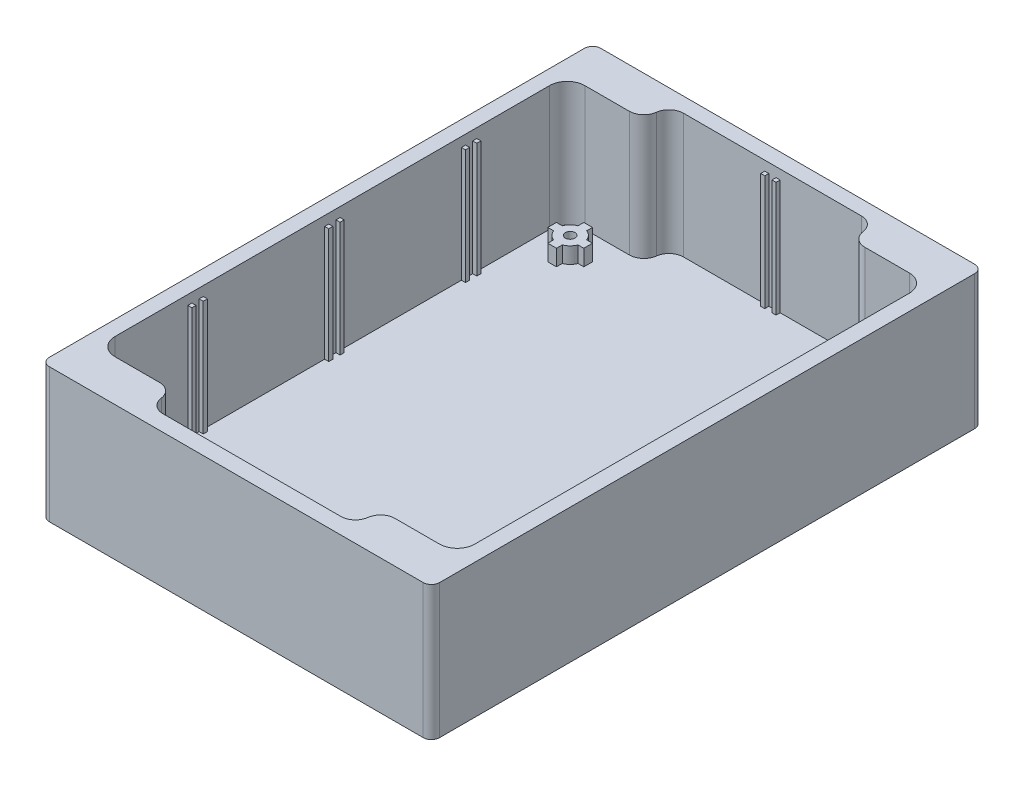
from build123d import *

# Parameters (mm, degrees)
BOSS_EXTRUDE1_DEPTH     = 41.656
CUT_EXTRUDE1_DEPTH      = 38.608
SKETCH7_R               = 1.5
BOSS_EXTRUDE2_DEPTH     = 5
MIRROR2_COPY_1_DEPTH    = 38.608
MIRROR2_COPY_2_SKETCH_R = 1.5
MIRROR2_COPY_2_DEPTH    = 5
BOSS_EXTRUDE3_START     = -2.9464
SKETCH9_W               = 1.27
SKETCH9_H               = 1.27
BOSS_EXTRUDE3_DEPTH     = 35.6616
BOSS_EXTRUDE4_START     = -2.9464
SKETCH10_W              = 1.27
SKETCH10_H              = 1.27
BOSS_EXTRUDE4_DEPTH     = 35.6616


with BuildPart() as part:
    # Sketch3 → Boss-Extrude1 (new body)
    with BuildSketch(Plane(origin=(0, 0, 0), x_dir=(1, 0, 0), z_dir=(0, 1, 0))):
        with BuildLine():
            Line((58.096932885, -85.686632753), (-57.828667115, -85.686632753))
            ThreePointArc((-57.828667115, -85.686632753), (-59.624718339, -84.942683977), (-60.368667115, -83.146632753))
            Line((-60.368667115, -83.146632753), (-60.368667115, 82.766167247))
            ThreePointArc((-60.368667115, 82.766167247), (-59.624718339, 84.562218471), (-57.828667115, 85.306167247))
            Line((-57.828667115, 85.306167247), (58.096932885, 85.306167247))
            ThreePointArc((58.096932885, 85.306167247), (59.892984109, 84.562218471), (60.636932885, 82.766167247))
            Line((60.636932885, 82.766167247), (60.636932885, -83.146632753))
            ThreePointArc((60.636932885, -83.146632753), (59.892984109, -84.942683977), (58.096932885, -85.686632753))
        make_face()
    extrude(amount=BOSS_EXTRUDE1_DEPTH)

    # Sketch6 → Cut-Extrude1 (cut)
    with BuildSketch(Plane(origin=(0, 41.656, 0), x_dir=(1, 0, 0), z_dir=(0, 1, 0))):
        with BuildLine():
            Line((-55.771267115, -0.190232753), (-55.771267115, 67.373392964))
            ThreePointArc((-55.771267115, 67.373392964), (-54.171667622, 71.235167754), (-50.309892833, 72.834767247))
            Line((-50.309892833, 72.834767247), (-36.517896511, 72.834767247))
            ThreePointArc((-36.517896511, 72.834767247), (-33.539782988, 73.959370118), (-32.04836951, 76.771767247))
            ThreePointArc((-32.04836951, 76.771767247), (-30.556956031, 79.584164375), (-27.578842508, 80.708767247))
            Line((-27.578842508, 80.708767247), (0.134132885, 80.708767247))
            Line((0.134132885, 80.708767247), (0.134132885, -0.190232753))
            Line((0.134132885, -0.190232753), (-55.771267115, -0.190232753))
        make_face()
    cut_extrude1 = extrude(amount=-CUT_EXTRUDE1_DEPTH, mode=Mode.SUBTRACT)

    # Sketch7 → Boss-Extrude2 (add)
    with BuildSketch(Plane(origin=(0, 3.048, 0), x_dir=(1, 0, 0), z_dir=(0, 1, 0))):
        with BuildLine():
            Line((-47.317674081, 67.712862285), (-47.317674081, 69.529651141))
            Line((-47.317674081, 69.529651141), (-44.630325919, 69.529651141))
            Line((-44.630325919, 69.529651141), (-44.630325919, 67.712862285))
            ThreePointArc((-44.630325919, 67.712862285), (-43.145219322, 66.773547925), (-42.205904962, 65.288441328))
            Line((-42.205904962, 65.288441328), (-40.389116105, 65.288441328))
            Line((-40.389116105, 65.288441328), (-40.389116105, 62.601093165))
            Line((-40.389116105, 62.601093165), (-42.205904962, 62.601093165))
            ThreePointArc((-42.205904962, 62.601093165), (-43.145219322, 61.115986569), (-44.630325919, 60.176672209))
            Line((-44.630325919, 60.176672209), (-44.630325919, 58.359883352))
            Line((-44.630325919, 58.359883352), (-47.317674081, 58.359883352))
            Line((-47.317674081, 58.359883352), (-47.317674081, 60.176672209))
            ThreePointArc((-47.317674081, 60.176672209), (-48.802780678, 61.115986569), (-49.742095038, 62.601093165))
            Line((-49.742095038, 62.601093165), (-51.558883895, 62.601093165))
            Line((-51.558883895, 62.601093165), (-51.558883895, 65.288441328))
            Line((-51.558883895, 65.288441328), (-49.742095038, 65.288441328))
            ThreePointArc((-49.742095038, 65.288441328), (-48.802780678, 66.773547925), (-47.317674081, 67.712862285))
        make_face()
        with Locations(Location((-45.974, 63.944767247, 0), (0, 0, 270))):
            Circle(SKETCH7_R, mode=Mode.SUBTRACT)
    boss_extrude2 = extrude(amount=BOSS_EXTRUDE2_DEPTH)

    # Mirror1: Cut-Extrude1, Boss-Extrude2 across plane
    add(cut_extrude1.mirror(Plane(origin=(0, 0, 0), x_dir=(0, 0, 1), z_dir=(1, 0, 0))), mode=Mode.SUBTRACT)
    add(boss_extrude2.mirror(Plane(origin=(0, 0, 0), x_dir=(0, 0, 1), z_dir=(1, 0, 0))))

    # Mirror2: Cut-Extrude1, Boss-Extrude2 across plane
    add(cut_extrude1.mirror(Plane.XY), mode=Mode.SUBTRACT)
    add(boss_extrude2.mirror(Plane.XY))

    # Mirror2 copy 1 sketch → Mirror2 copy 1 (cut)
    with BuildSketch(Plane(origin=(0, 41.656, 0), x_dir=(-1, 0, 0), z_dir=(0, 1, 0))):
        with BuildLine():
            Line((-55.771267115, -0.190232753), (-55.771267115, 67.373392964))
            ThreePointArc((-55.771267115, 67.373392964), (-54.171667622, 71.235167754), (-50.309892833, 72.834767247))
            Line((-50.309892833, 72.834767247), (-36.517896511, 72.834767247))
            ThreePointArc((-36.517896511, 72.834767247), (-33.539782988, 73.959370118), (-32.04836951, 76.771767247))
            ThreePointArc((-32.04836951, 76.771767247), (-30.556956031, 79.584164375), (-27.578842508, 80.708767247))
            Line((-27.578842508, 80.708767247), (0.134132885, 80.708767247))
            Line((0.134132885, 80.708767247), (0.134132885, -0.190232753))
            Line((0.134132885, -0.190232753), (-55.771267115, -0.190232753))
        make_face()
    extrude(amount=-MIRROR2_COPY_1_DEPTH, mode=Mode.SUBTRACT)

    # Mirror2 copy 2 sketch → Mirror2 copy 2 (add)
    with BuildSketch(Plane(origin=(0, 3.048, 0), x_dir=(-1, 0, 0), z_dir=(0, 1, 0))):
        with BuildLine():
            Line((-47.317674081, 67.712862285), (-47.317674081, 69.529651141))
            Line((-47.317674081, 69.529651141), (-44.630325919, 69.529651141))
            Line((-44.630325919, 69.529651141), (-44.630325919, 67.712862285))
            ThreePointArc((-44.630325919, 67.712862285), (-43.145219322, 66.773547925), (-42.205904962, 65.288441328))
            Line((-42.205904962, 65.288441328), (-40.389116105, 65.288441328))
            Line((-40.389116105, 65.288441328), (-40.389116105, 62.601093165))
            Line((-40.389116105, 62.601093165), (-42.205904962, 62.601093165))
            ThreePointArc((-42.205904962, 62.601093165), (-43.145219322, 61.115986569), (-44.630325919, 60.176672209))
            Line((-44.630325919, 60.176672209), (-44.630325919, 58.359883352))
            Line((-44.630325919, 58.359883352), (-47.317674081, 58.359883352))
            Line((-47.317674081, 58.359883352), (-47.317674081, 60.176672209))
            ThreePointArc((-47.317674081, 60.176672209), (-48.802780678, 61.115986569), (-49.742095038, 62.601093165))
            Line((-49.742095038, 62.601093165), (-51.558883895, 62.601093165))
            Line((-51.558883895, 62.601093165), (-51.558883895, 65.288441328))
            Line((-51.558883895, 65.288441328), (-49.742095038, 65.288441328))
            ThreePointArc((-49.742095038, 65.288441328), (-48.802780678, 66.773547925), (-47.317674081, 67.712862285))
        make_face()
        with Locations(Location((-45.974, 63.944767247, 0), (0, 0, 270))):
            Circle(MIRROR2_COPY_2_SKETCH_R, mode=Mode.SUBTRACT)
    extrude(amount=MIRROR2_COPY_2_DEPTH)

    # Sketch9 → Boss-Extrude3 (add)
    with BuildSketch(Plane(origin=(0, 41.656, 0), x_dir=(1, 0, 0), z_dir=(0, 1, 0)).offset(BOSS_EXTRUDE3_START)):
        with Locations((-1.7526, 80.073767247)):
            Rectangle(SKETCH9_W, SKETCH9_H)
        with Locations((1.7526, 80.073767247)):
            Rectangle(SKETCH9_W, SKETCH9_H)
    boss_extrude3 = extrude(amount=-BOSS_EXTRUDE3_DEPTH)

    # Mirror3: Boss-Extrude3 across plane
    add(boss_extrude3.mirror(Plane.XY))

    # Sketch10 → Boss-Extrude4 (add)
    with BuildSketch(Plane(origin=(0, 41.656, 0), x_dir=(1, 0, 0), z_dir=(0, 1, 0)).offset(BOSS_EXTRUDE4_START)):
        with Locations((55.136267115, -1.7526)):
            Rectangle(SKETCH10_W, SKETCH10_H)
        with Locations((55.136267115, 1.7526)):
            Rectangle(SKETCH10_W, SKETCH10_H)
        with Locations((55.136267115, 40.6654)):
            Rectangle(SKETCH10_W, SKETCH10_H)
        with Locations((55.136267115, 44.1706)):
            Rectangle(SKETCH10_W, SKETCH10_H)
        with Locations((55.136267115, -44.1706)):
            Rectangle(SKETCH10_W, SKETCH10_H)
        with Locations((55.136267115, -40.6654)):
            Rectangle(SKETCH10_W, SKETCH10_H)
    boss_extrude4 = extrude(amount=-BOSS_EXTRUDE4_DEPTH)

    # Mirror4: Boss-Extrude4 across plane
    add(boss_extrude4.mirror(Plane(origin=(0, 0, 0), x_dir=(0, 0, 1), z_dir=(1, 0, 0))))


solid = part.part
